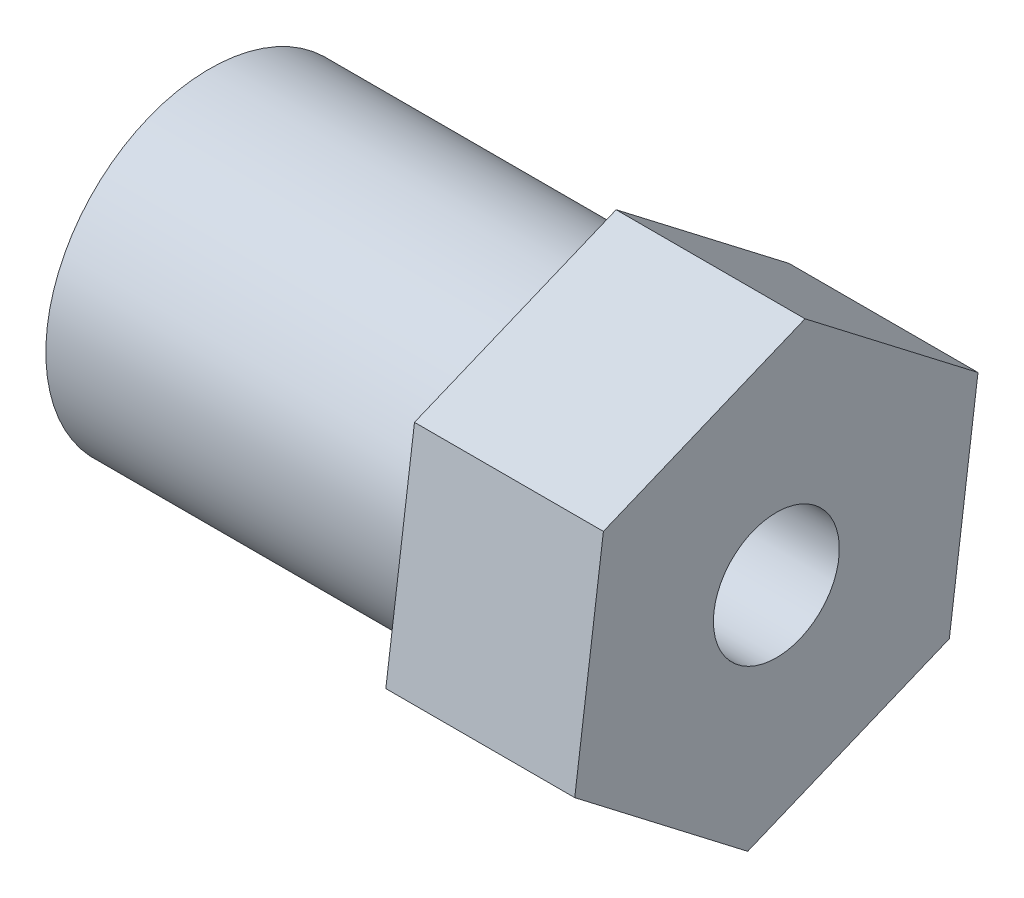
from build123d import *

# Parameters (mm, degrees)
EXTRUDE_1_DEPTH                = 6
SKETCH_2_W                     = 12
SKETCH_2_H                     = 5.2
HOLE_WIZARD_M3_5_1_D           = 4
HOLE_WIZARD_M3_5_1_CBORE_D     = 5
HOLE_WIZARD_M3_5_1_CBORE_DEPTH = 12
SKETCH_5_W                     = 1.5
SKETCH_5_H                     = 6.915054242


with BuildPart() as part:
    # 草图1 → 凸台-拉伸1 (new body)
    with BuildSketch(Plane(origin=(88, 0, 0), x_dir=(0, 0, -1), z_dir=(1, 0, 0))):
        Polygon((27.096784191, 197.354470317), (32.589488008, 193.131887602), (38.992703817, 195.777417285), (39.903215809, 202.645529683), (34.410511992, 206.868112398), (28.007296183, 204.222582715), align=None)
    extrude(amount=-EXTRUDE_1_DEPTH)

    # 草图2 → 旋转1 (revolve)
    with BuildSketch(Plane.XY.offset(-33.5), mode=Mode.PRIVATE) as revolve_1_sk:
        with Locations((76, 202.6)):
            Rectangle(SKETCH_2_W, SKETCH_2_H)
    revolve(revolve_1_sk.sketch.rotate(Axis((70, 200, -33.5), (1, 0, 0)), 270), axis=Axis((70, 200, -33.5), (1, 0, 0)))

    # M3.5 六角头机械螺钉的柱形沉头孔1 (through all)
    with Locations(Plane.ZY.offset(-70)):
        with Locations((-33.5, 200)):
            CounterBoreHole(HOLE_WIZARD_M3_5_1_D / 2, HOLE_WIZARD_M3_5_1_CBORE_D / 2, HOLE_WIZARD_M3_5_1_CBORE_DEPTH)

    # 草图5 → Ø3.0 (3) 直径孔1 (revolve, cut)
    with BuildSketch(Plane(origin=(74, 198.322079162, -34.356128365), x_dir=(0, -0.3818493186865922, 0.9242245927363032), z_dir=(1, 0, 0))):
        with Locations((0.75, 3.457527121)):
            Rectangle(SKETCH_5_W, SKETCH_5_H)
    revolve(axis=Axis((74, 204.190905326, -31.931385192), (0, -0.9242245927363031, -0.38184931868659217)), mode=Mode.SUBTRACT)


solid = part.part
